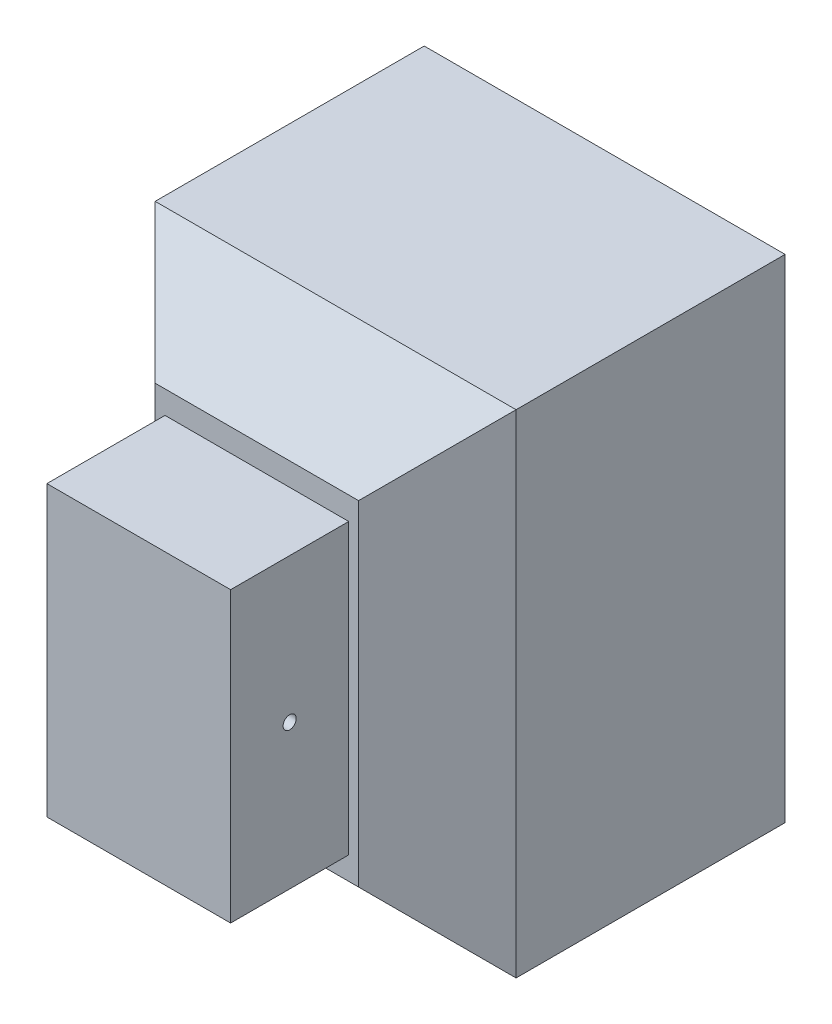
from build123d import *

# Parameters (mm, degrees)
SKETCH1_W               = 75
SKETCH1_H               = 65
BOSS_EXTRUDE1_DEPTH     = 55
SKETCH2_W               = 28
SKETCH2_H               = 44
BOSS_EXTRUDE2_DEPTH     = 18
CHAMFER1_SIZE           = 12
CUT_EXTRUDE1_DEPTH      = 77.154844523
CUT_EXTRUDE1_DEPTH_BACK = 77.154844523
SKETCH3_R               = 1


with BuildPart() as part:
    # Sketch1 → Boss-Extrude1 (new body)
    with BuildSketch(Plane.YZ):
        with Locations((5.396678967, -3.201107011)):
            Rectangle(SKETCH1_W, SKETCH1_H)
    extrude(amount=BOSS_EXTRUDE1_DEPTH)

    # Sketch2 → Boss-Extrude2 (add)
    with BuildSketch(Plane.XY.offset(29.298892989)):
        with Locations((27.5, 5.396678967)):
            Rectangle(SKETCH2_W, SKETCH2_H)
    extrude(amount=BOSS_EXTRUDE2_DEPTH)

    # Chamfer1
    chamfer1_edges = [part.edges().sort_by_distance(p)[0] for p in [
        (55, 5.396678967, 29.298892989),
        (0, 5.396678967, 29.298892989),
        (0, 5.396678967, -35.701107011),
        (27.5, -32.103321033, 29.298892989),
        (27.5, 42.896678967, 29.298892989),
        (27.5, 42.896678967, -35.701107011),
        (27.5, -32.103321033, -35.701107011),
        (55, 5.396678967, -35.701107011),
    ]]
    chamfer(chamfer1_edges, length=CHAMFER1_SIZE)

    # Sketch3 → Cut-Extrude1 (cut, two sides: drawn at the far end of the back side and taken through both)
    with BuildSketch(Plane.YZ.offset(41.5).offset(-CUT_EXTRUDE1_DEPTH_BACK)):
        with Locations((5.396678967, 38.298892989)):
            Circle(SKETCH3_R)
    extrude(amount=CUT_EXTRUDE1_DEPTH + CUT_EXTRUDE1_DEPTH_BACK, mode=Mode.SUBTRACT)


solid = part.part
